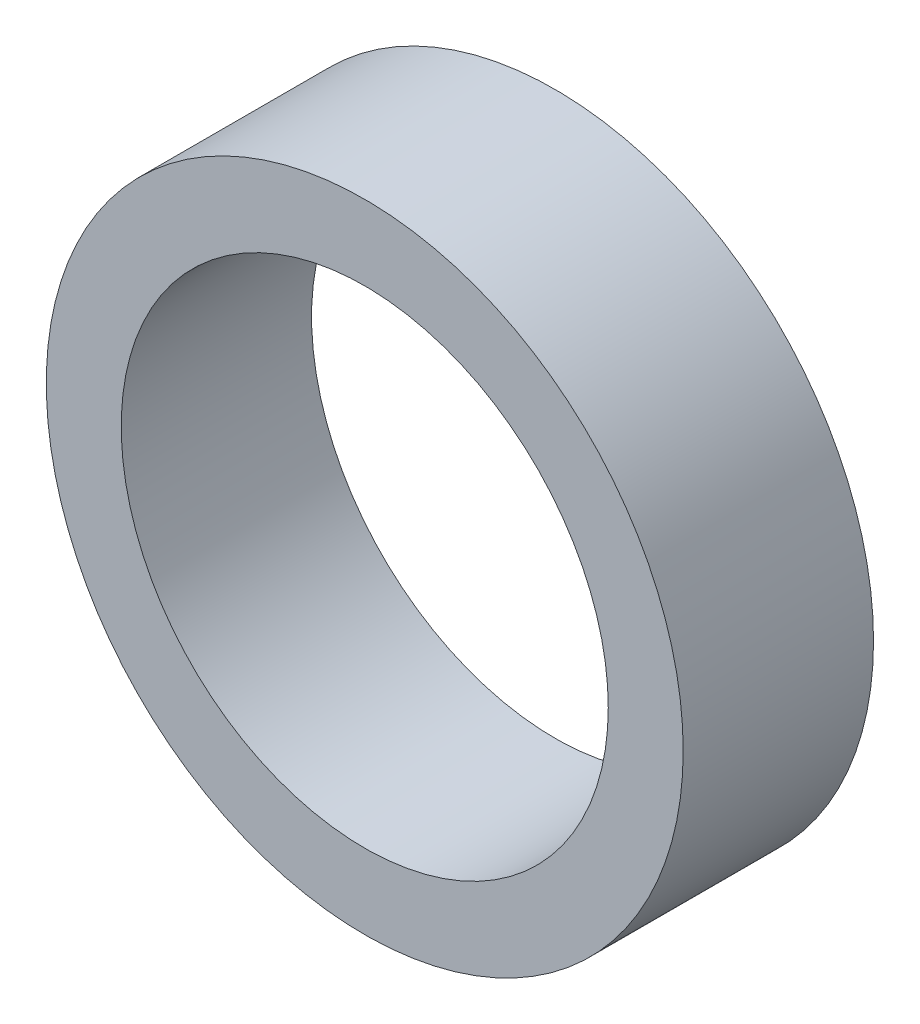
from build123d import *

# Parameters (mm, degrees)
SKETCH1_R           = 4.25
SKETCH1_R_2         = 3.25
BOSS_EXTRUDE1_DEPTH = 2.54


with BuildPart() as part:
    # Sketch1 → Boss-Extrude1 (new body)
    with BuildSketch(Plane.XY):
        Circle(SKETCH1_R)
        Circle(SKETCH1_R_2, mode=Mode.SUBTRACT)
    extrude(amount=BOSS_EXTRUDE1_DEPTH)


solid = part.part
